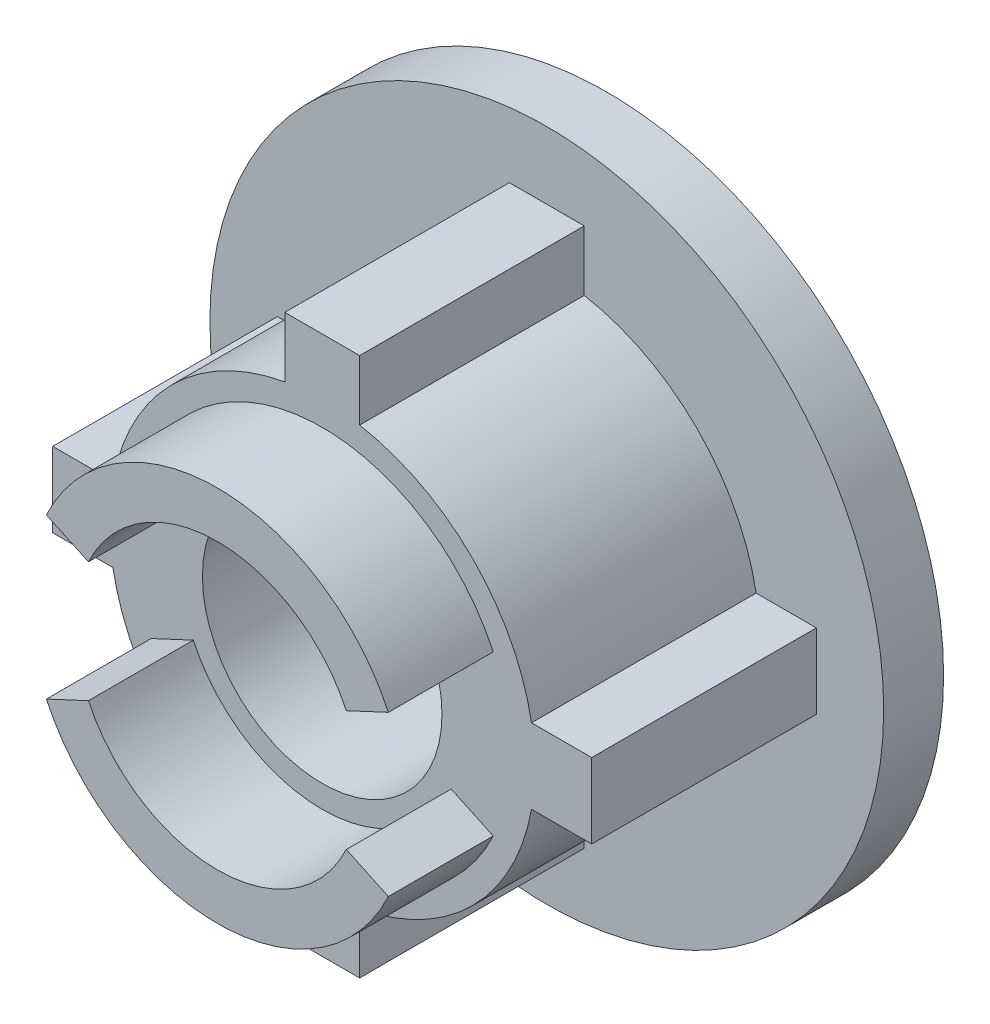
from build123d import *
from build123d.topology import SkipClean

# Parameters (mm, degrees)
ESBO_O1_R                = 11.15
RESSALTO_EXTRUS_O1_DEPTH = 15
ESBO_O2_R                = 22.5
RESSALTO_EXTRUS_O2_DEPTH = 4
RESSALTO_EXTRUS_O6_START = -8
ESBO_O5_R                = 11.15
ESBO_O5_R_2              = 8
RESSALTO_EXTRUS_O6_DEPTH = 8
RESSALTO_EXTRUS_O7_START = 4
ESBO_O7_R                = 14.2
ESBO_O7_R_2              = 11.15
RESSALTO_EXTRUS_O7_DEPTH = 4
RESSALTO_EXTRUS_O8_START = 4
ESBO_O8_R                = 11.15
ESBO_O8_R_2              = 8
RESSALTO_EXTRUS_O8_DEPTH = 4
RESSALTO_EXTRUS_O9_DEPTH = 7


with BuildPart() as part:
    # Esboço1 → Ressalto-extrusão1 (new body)
    with BuildSketch(Plane.XY):
        with BuildLine():
            Line((-2.5, 18), (-2.5, 13.978197309))
            ThreePointArc((-2.5, 13.978197309), (-10.040916293, 10.040916293), (-13.978197309, 2.5))
            Line((-13.978197309, 2.5), (-18, 2.5))
            Line((-18, 2.5), (-18, -2.5))
            Line((-18, -2.5), (-13.978197309, -2.5))
            ThreePointArc((-13.978197309, -2.5), (-10.040916293, -10.040916293), (-2.5, -13.978197309))
            Line((-2.5, -13.978197309), (-2.5, -18))
            Line((-2.5, -18), (2.5, -18))
            Line((2.5, -18), (2.5, -13.978197309))
            ThreePointArc((2.5, -13.978197309), (10.040916293, -10.040916293), (13.978197309, -2.5))
            Line((13.978197309, -2.5), (18, -2.5))
            Line((18, -2.5), (18, 2.5))
            Line((18, 2.5), (13.978197309, 2.5))
            ThreePointArc((13.978197309, 2.5), (10.040916293, 10.040916293), (2.5, 13.978197309))
            Line((2.5, 13.978197309), (2.5, 18))
            Line((2.5, 18), (-2.5, 18))
        make_face()
        Circle(ESBO_O1_R, mode=Mode.SUBTRACT)
    extrude(amount=RESSALTO_EXTRUS_O1_DEPTH)

    # Esboço5 → Ressalto-extrusão6 (add)
    with BuildSketch(Plane.XY.offset(15).offset(RESSALTO_EXTRUS_O6_START)):
        Circle(ESBO_O5_R)
        Circle(ESBO_O5_R_2, mode=Mode.SUBTRACT)
    extrude(amount=RESSALTO_EXTRUS_O6_DEPTH)



with BuildPart() as body_2:
    # Esboço2 → Ressalto-extrusão2 (new body)
    # profile 1 of 5: a face of its own
    with SkipClean():  # the faces are left unmerged after this step: merging them gives an invalid solid
        with BuildSketch(Plane(origin=(0, 0, 0), x_dir=(-1, 0, 0), z_dir=(0, 0, -1))):
            Circle(ESBO_O2_R)
            with BuildLine():
                Line((2.5, 13.978197309), (2.5, 18))
                Line((2.5, 18), (-2.5, 18))
                Line((-2.5, 18), (-2.5, 13.978197309))
                ThreePointArc((-2.5, 13.978197309), (-10.040916293, 10.040916293), (-13.978197309, 2.5))
                Line((-13.978197309, 2.5), (-18, 2.5))
                Line((-18, 2.5), (-18, -2.5))
                Line((-18, -2.5), (-13.978197309, -2.5))
                ThreePointArc((-13.978197309, -2.5), (-10.040916293, -10.040916293), (-2.5, -13.978197309))
                Line((-2.5, -13.978197309), (-2.5, -18))
                Line((-2.5, -18), (2.5, -18))
                Line((2.5, -18), (2.5, -13.978197309))
                ThreePointArc((2.5, -13.978197309), (10.040916293, -10.040916293), (13.978197309, -2.5))
                Line((13.978197309, -2.5), (18, -2.5))
                Line((18, -2.5), (18, 2.5))
                Line((18, 2.5), (13.978197309, 2.5))
                ThreePointArc((13.978197309, 2.5), (10.040916293, 10.040916293), (2.5, 13.978197309))
            make_face(mode=Mode.SUBTRACT)
        # profile 2 of 5: a face of its own
        with BuildSketch(Plane(origin=(0, 0, 0), x_dir=(-1, 0, 0), z_dir=(0, 0, -1))):
            with BuildLine():
                Line((2.5, -18), (2.5, -13.978197309))
                ThreePointArc((2.5, -13.978197309), (0, -14.2), (-2.5, -13.978197309))
                Line((-2.5, -13.978197309), (-2.5, -18))
                Line((-2.5, -18), (2.5, -18))
            make_face()
        # profile 3 of 5: a face of its own
        with BuildSketch(Plane(origin=(0, 0, 0), x_dir=(-1, 0, 0), z_dir=(0, 0, -1))):
            with BuildLine():
                ThreePointArc((-13.978197309, -2.5), (-14.2, 0), (-13.978197309, 2.5))
                Line((-13.978197309, 2.5), (-18, 2.5))
                Line((-18, 2.5), (-18, -2.5))
                Line((-18, -2.5), (-13.978197309, -2.5))
            make_face()
        # profile 4 of 5: a face of its own
        with BuildSketch(Plane(origin=(0, 0, 0), x_dir=(-1, 0, 0), z_dir=(0, 0, -1))):
            with BuildLine():
                ThreePointArc((-2.5, 13.978197309), (0, 14.2), (2.5, 13.978197309))
                Line((2.5, 13.978197309), (2.5, 18))
                Line((2.5, 18), (-2.5, 18))
                Line((-2.5, 18), (-2.5, 13.978197309))
            make_face()
        # profile 5 of 5: a face of its own
        with BuildSketch(Plane(origin=(0, 0, 0), x_dir=(-1, 0, 0), z_dir=(0, 0, -1))):
            with BuildLine():
                Line((18, 2.5), (13.978197309, 2.5))
                ThreePointArc((13.978197309, 2.5), (14.2, 0), (13.978197309, -2.5))
                Line((13.978197309, -2.5), (18, -2.5))
                Line((18, -2.5), (18, 2.5))
            make_face()
        extrude(amount=RESSALTO_EXTRUS_O2_DEPTH)


with BuildPart() as part_1:
    with SkipClean():  # the faces are left unmerged after this step: merging them gives an invalid solid
        add(part.part)

        add(body_2.part)  # Ressalto-extrusão7 merges body 2
        # Esboço7 → Ressalto-extrusão7 (add)
        with BuildSketch(Plane(origin=(0, 0, 0), x_dir=(-1, 0, 0), z_dir=(0, 0, -1)).offset(RESSALTO_EXTRUS_O7_START)):
            Circle(ESBO_O7_R)
            with Locations(Location((0, 0, 0), (0, 0, 180))):
                Circle(ESBO_O7_R_2, mode=Mode.SUBTRACT)
        extrude(amount=-RESSALTO_EXTRUS_O7_DEPTH)

    # Esboço8 → Ressalto-extrusão8 (add)
    with BuildSketch(Plane(origin=(0, 0, 7), x_dir=(-1, 0, 0), z_dir=(0, 0, -1)).offset(RESSALTO_EXTRUS_O8_START)):
        Circle(ESBO_O8_R)
        with Locations(Location((0, 0, 0), (0, 0, 180))):
            Circle(ESBO_O8_R_2, mode=Mode.SUBTRACT)
    extrude(amount=-RESSALTO_EXTRUS_O8_DEPTH)

    # Esboço9 → Ressalto-extrusão9 (add)
    with BuildSketch(Plane.XY.offset(15)):
        with BuildLine():
            Line((-11.419478117, 5.324990098), (-8.609923977, 4.014873487))
            ThreePointArc((-8.609923977, 4.014873487), (0, 9.5), (8.609923977, 4.014873487))
            Line((8.609923977, 4.014873487), (11.419478117, 5.324990098))
            ThreePointArc((11.419478117, 5.324990098), (0, 12.6), (-11.419478117, 5.324990098))
        make_face()
        with BuildLine():
            Line((-11.419478117, -5.324990098), (-8.609923977, -4.014873487))
            ThreePointArc((-8.609923977, -4.014873487), (0, -9.5), (8.609923977, -4.014873487))
            Line((8.609923977, -4.014873487), (11.419478117, -5.324990098))
            ThreePointArc((11.419478117, -5.324990098), (0, -12.6), (-11.419478117, -5.324990098))
        make_face()
    extrude(amount=RESSALTO_EXTRUS_O9_DEPTH)


solid = part_1.part
